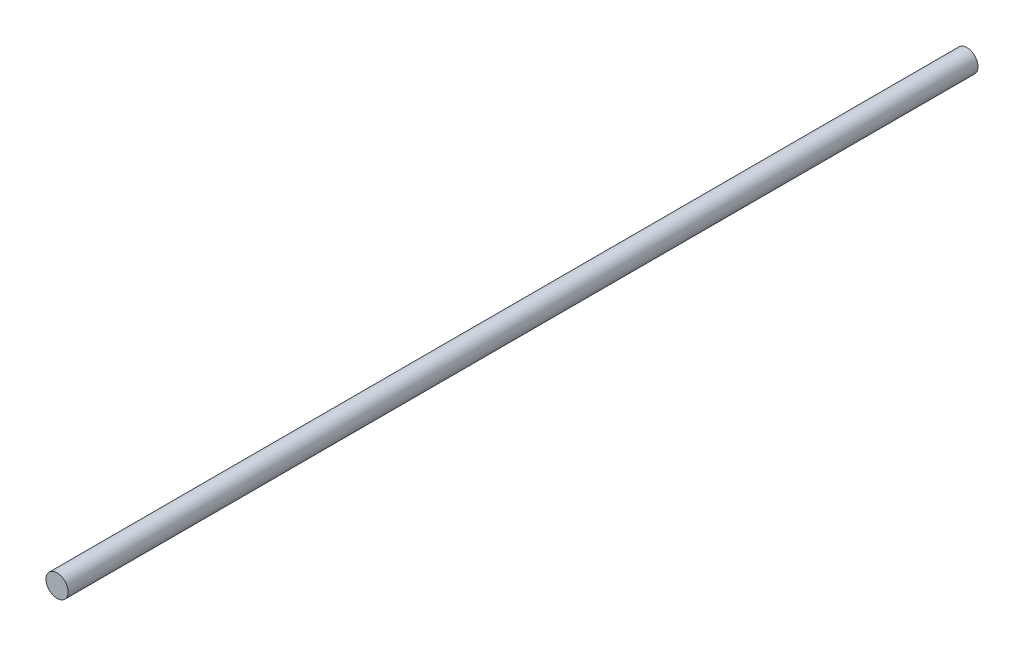
from build123d import *

# Parameters (mm, degrees)
SKETCH1_R           = 2
BOSS_EXTRUDE1_DEPTH = 82


with BuildPart() as part:
    # Sketch1 → Boss-Extrude1 (new, symmetric)
    with BuildSketch(Plane.XY):
        Circle(SKETCH1_R)
    extrude(amount=BOSS_EXTRUDE1_DEPTH, both=True)


solid = part.part
